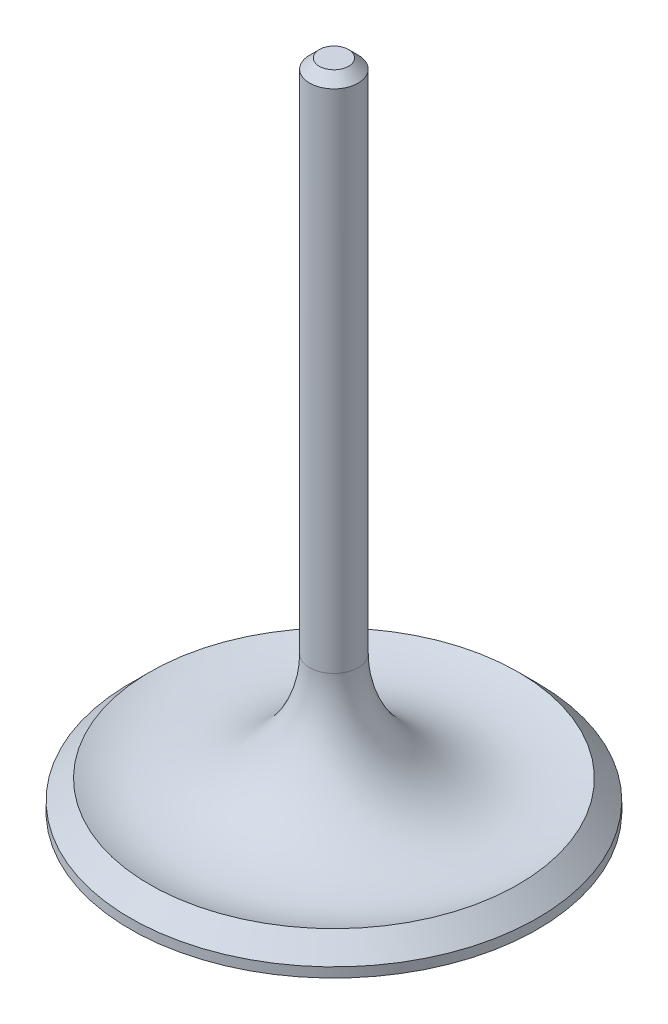
from build123d import *

# Parameters (mm, degrees)
CHAMFER1_SIZE = 32.258
SCALE1_SCALE  = 0.039370079


with BuildPart() as part:
    # Sketch1 → Revolve1 (revolve)
    with BuildSketch(Plane(origin=(0, 0, 0), x_dir=(0, 0, -1), z_dir=(1, 0, 0))):
        with BuildLine():
            Line((0, 0), (0, 2172.97))
            Line((0, 2172.97), (80.772, 2172.97))
            Line((80.772, 2172.97), (80.772, 456.0493458))
            ThreePointArc((80.772, 456.0493458), (251.373886398, 135.019319557), (612.902, 96.774))
            Line((612.902, 96.774), (677.418, 32.258))
            Line((677.418, 32.258), (677.418, 0))
            Line((677.418, 0), (0, 0))
        make_face()
    revolve(axis=Axis((0, 0, 0), (0, 1, 0)))

    # Chamfer1
    chamfer1_edges = [part.edges().sort_by_distance(p)[0] for p in [
        (0, 2172.97, 80.772),
    ]]
    chamfer(chamfer1_edges, length=CHAMFER1_SIZE)


with BuildPart() as part_1:
    # Scale1: scaled about (0, 313.343453497, 0)
    add(part.part.scale(SCALE1_SCALE).moved(Location((0, 301.00709706, 0))))


solid = part_1.part
